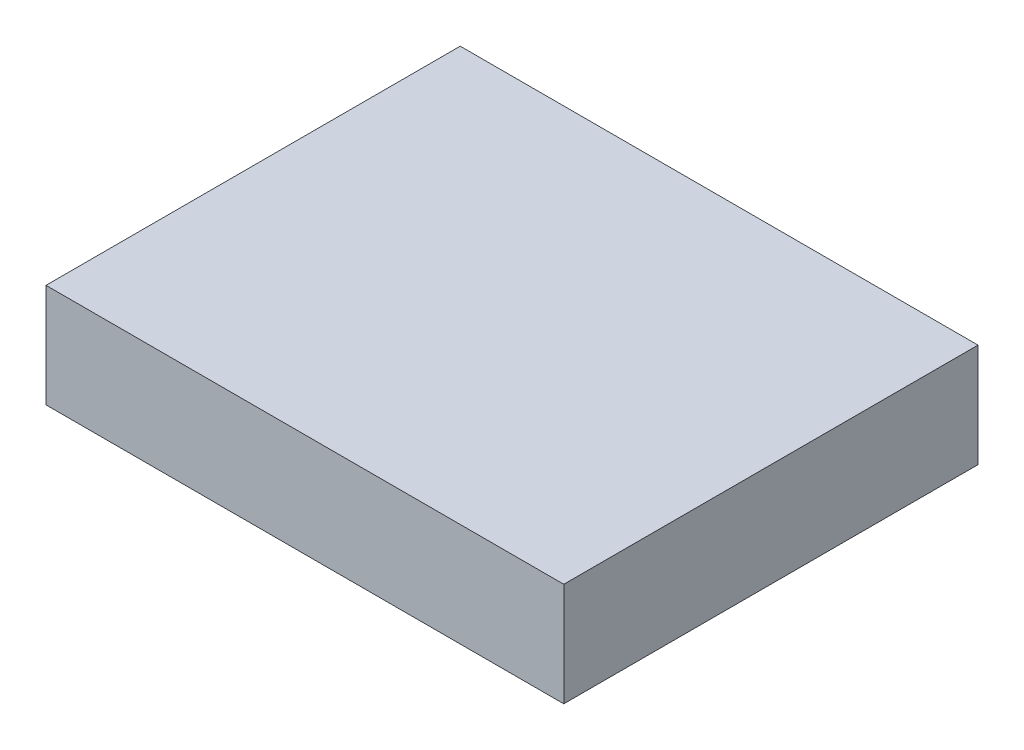
from build123d import *

# Parameters (mm, degrees)
SKETCH1_W           = 25
SKETCH1_H           = 5
BOSS_EXTRUDE1_DEPTH = 20


with BuildPart() as part:
    # Sketch1 → Boss-Extrude1 (new body)
    with BuildSketch(Plane.XY):
        with Locations((12.5, 2.5)):
            Rectangle(SKETCH1_W, SKETCH1_H)
    extrude(amount=BOSS_EXTRUDE1_DEPTH)


solid = part.part
